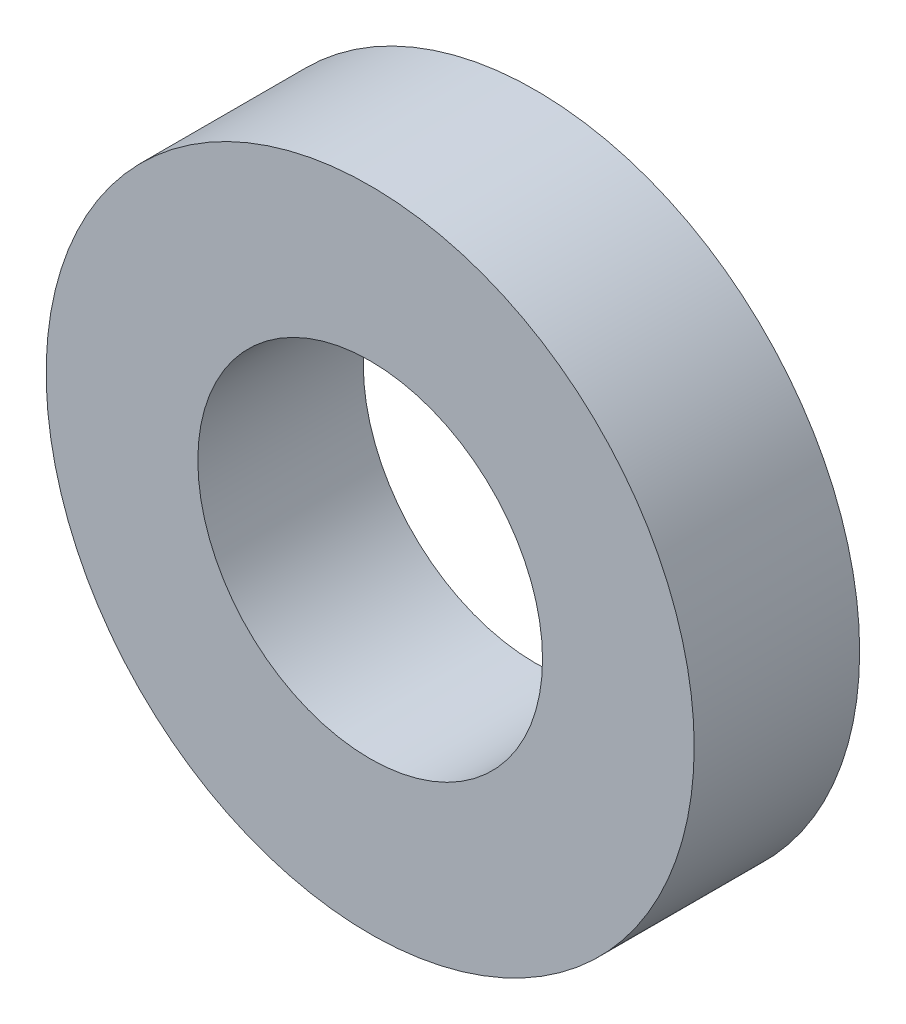
from build123d import *

# Parameters (mm, degrees)
SKETCH1_R           = 23.5
SKETCH1_R_2         = 12.5
BOSS_EXTRUDE1_DEPTH = 12


with BuildPart() as part:
    # Sketch1 → Boss-Extrude1 (new body)
    with BuildSketch(Plane.XY):
        Circle(SKETCH1_R)
        Circle(SKETCH1_R_2, mode=Mode.SUBTRACT)
    extrude(amount=BOSS_EXTRUDE1_DEPTH)


solid = part.part
